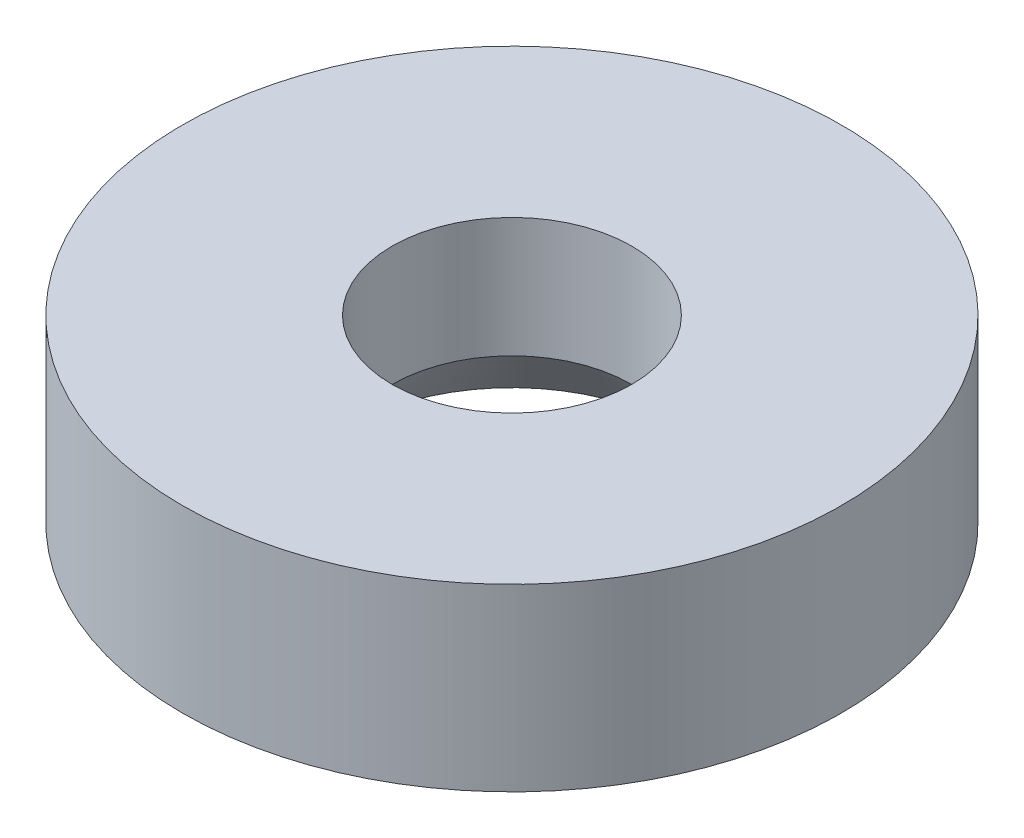
from build123d import *


with BuildPart() as part:
    # Sketch1 → Revolve1 (revolve)
    with BuildSketch(Plane.XY, mode=Mode.PRIVATE) as revolve1_sk:
        Polygon((0.4, 0.6), (1.1, 0.6), (1.1, 0), (0.552542373, 0), (0.4, 0.2), align=None)
    revolve(revolve1_sk.sketch.rotate(Axis((0, 1.228813559, 0), (0, -1, 0)), 90), axis=Axis((0, 1.228813559, 0), (0, -1, 0)))


solid = part.part
